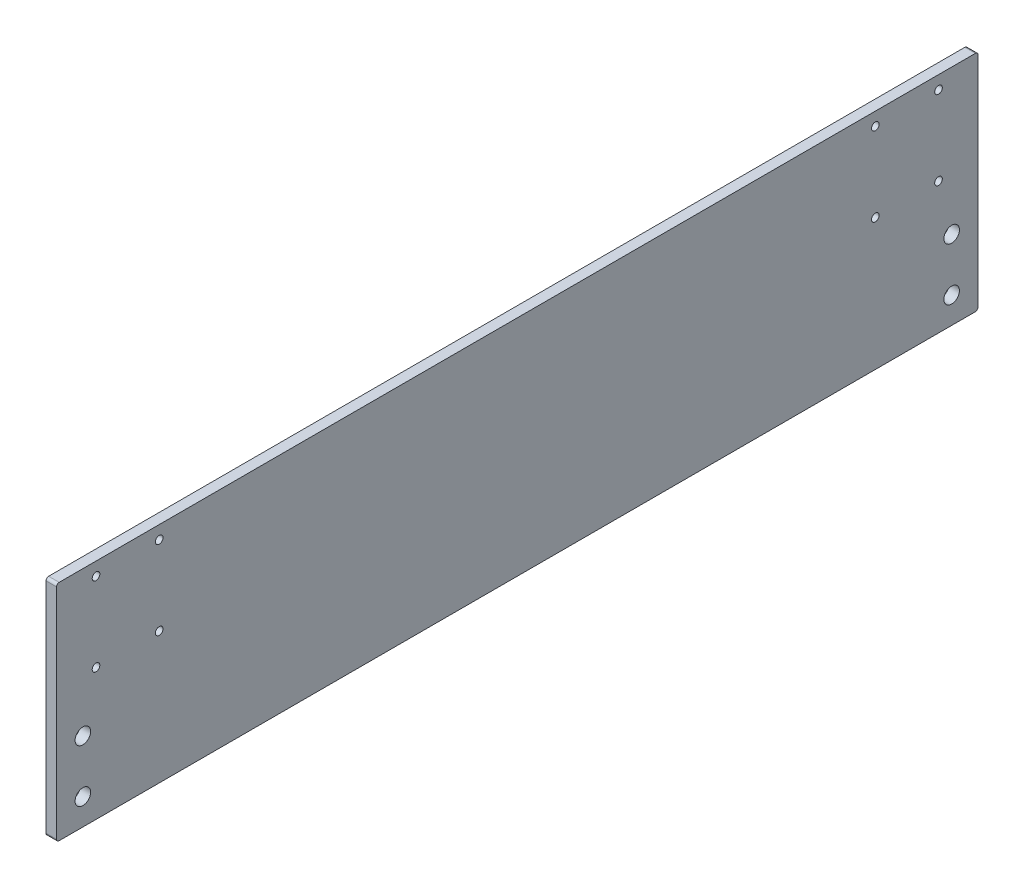
from build123d import *

# Parameters (mm, degrees)
SKETCH_1_W      = 350
SKETCH_1_H      = 85
SKETCH_1_R      = 2.95
SKETCH_1_R_2    = 1.45
EXTRUDE_1_DEPTH = 4
FILLET_1_R      = 1


with BuildPart() as part:
    # 草图1 → 凸台-拉伸1 (new body)
    with BuildSketch(Plane(origin=(0, 0, 0), x_dir=(0, 0, -1), z_dir=(1, 0, 0))):
        with Locations((175, 42.5)):
            Rectangle(SKETCH_1_W, SKETCH_1_H)
        with Locations((10, 30)):
            Circle(SKETCH_1_R, mode=Mode.SUBTRACT)
        with Locations((10, 10)):
            Circle(SKETCH_1_R, mode=Mode.SUBTRACT)
        with Locations((15, 80)):
            Circle(SKETCH_1_R_2, mode=Mode.SUBTRACT)
        with Locations((39, 80)):
            Circle(SKETCH_1_R_2, mode=Mode.SUBTRACT)
        with Locations((15, 50)):
            Circle(SKETCH_1_R_2, mode=Mode.SUBTRACT)
        with Locations((39, 50)):
            Circle(SKETCH_1_R_2, mode=Mode.SUBTRACT)
        with Locations(Location((311, 50, 0), (0, 0, 180))):
            Circle(SKETCH_1_R_2, mode=Mode.SUBTRACT)
        with Locations(Location((335, 50, 0), (0, 0, 180))):
            Circle(SKETCH_1_R_2, mode=Mode.SUBTRACT)
        with Locations(Location((311, 80, 0), (0, 0, 180))):
            Circle(SKETCH_1_R_2, mode=Mode.SUBTRACT)
        with Locations(Location((335, 80, 0), (0, 0, 180))):
            Circle(SKETCH_1_R_2, mode=Mode.SUBTRACT)
        with Locations(Location((340, 10, 0), (0, 0, 180))):
            Circle(SKETCH_1_R, mode=Mode.SUBTRACT)
        with Locations(Location((340, 30, 0), (0, 0, 180))):
            Circle(SKETCH_1_R, mode=Mode.SUBTRACT)
    extrude(amount=EXTRUDE_1_DEPTH)

    # 圆角1
    fillet_1_edges = [part.edges().sort_by_distance(p)[0] for p in [
        (2, 85, 0),
        (2, 85, -350),
        (2, 0, -350),
        (2, 0, 0),
    ]]
    fillet(fillet_1_edges, radius=FILLET_1_R)


solid = part.part
